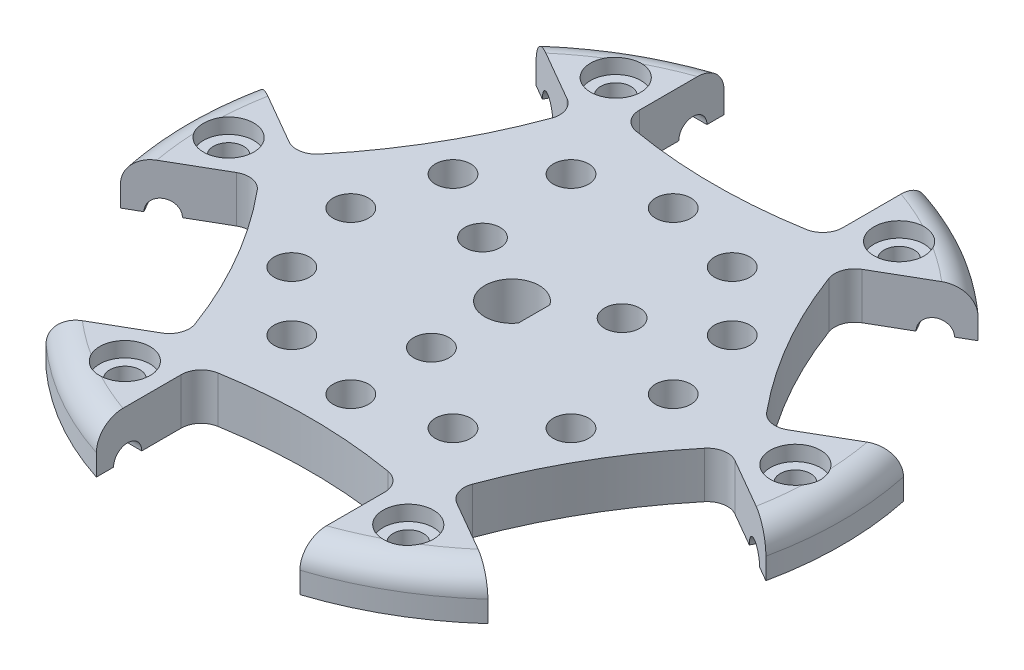
from build123d import *

# Parameters (mm, degrees)
CORTE_EXTRUS_O2_DEPTH = 10
ESBO_O5_W             = 25.2
ESBO_O5_H             = 1.4
ESBO_O10_W            = 25.2
ESBO_O10_H            = 1.4
ESBO_O12_R            = 1.75
ESBO_O12_R_2          = 1.3
CORTE_EXTRUS_O4_DEPTH = 46.434293366
ESBO_O13_R            = 2.05
ESBO_O13_R_2          = 2.04
CORTE_EXTRUS_O5_DEPTH = 1.5
CORTE_EXTRUS_O6_DEPTH = 46.434293366
ESBO_O15_R            = 1.5
CORTE_EXTRUS_O7_DEPTH = 46.434293366
ESBO_O16_R            = 2.5
CORTE_EXTRUS_O8_DEPTH = 1.5
CORTE_EXTRUS_O9_DEPTH = 46.434293366


with BuildPart() as part:
    # Esboço1 → Revolução3 (revolve)
    with BuildSketch(Plane.XY, mode=Mode.PRIVATE) as revolu_o3_sk:
        with BuildLine():
            Line((-32.75, 2.1), (-32.75, 0))
            Line((-32.75, 0), (0, 0))
            Line((0, 0), (0, 4.6))
            Line((0, 4.6), (-6.07, 4.6))
            Line((-6.07, 4.6), (-30.25, 4.6))
            ThreePointArc((-30.25, 4.6), (-32.017766953, 3.867766953), (-32.75, 2.1))
        make_face()
    revolve(revolu_o3_sk.sketch.rotate(Axis((0, 0, 0), (0, 1, 0)), 270), axis=Axis((0, 0, 0), (0, 1, 0)))

    # Esboço3 → Corte-extrusão2 (cut)
    with BuildSketch(Plane.XZ):
        with BuildLine():
            Line((-10.1, 71.55), (10.1, 71.55))
            Line((10.1, 71.55), (10.1, 22.738373522))
            ThreePointArc((10.1, 22.738373522), (9.628888485, 21.448993826), (8.4375, 20.767055752))
            ThreePointArc((8.4375, 20.767055752), (0, 20.05), (-8.4375, 20.767055752))
            ThreePointArc((-8.4375, 20.767055752), (-9.628888485, 21.448993826), (-10.1, 22.738373522))
            Line((-10.1, 22.738373522), (-10.1, 71.55))
        make_face()
        with BuildLine():
            Line((10.1, -71.55), (-10.1, -71.55))
            Line((-10.1, -71.55), (-10.1, -22.738373522))
            ThreePointArc((-10.1, -22.738373522), (-9.628888485, -21.448993826), (-8.4375, -20.767055752))
            ThreePointArc((-8.4375, -20.767055752), (0, -20.05), (8.4375, -20.767055752))
            ThreePointArc((8.4375, -20.767055752), (9.628888485, -21.448993826), (10.1, -22.738373522))
            Line((10.1, -22.738373522), (10.1, -71.55))
        make_face()
        with BuildLine():
            Line((56.914117641, 44.521856578), (67.014117641, 27.028143422))
            Line((67.014117641, 27.028143422), (24.742009111, 2.622330183))
            ThreePointArc((24.742009111, 2.622330183), (23.389817782, 2.385634875), (22.203547843, 3.076438532))
            ThreePointArc((22.203547843, 3.076438532), (17.363809346, 10.025), (13.766047843, 17.69061722))
            ThreePointArc((13.766047843, 17.69061722), (13.760929296, 19.063358951), (14.642009111, 20.116043339))
            Line((14.642009111, 20.116043339), (56.914117641, 44.521856578))
        make_face()
        with BuildLine():
            Line((-56.914117641, -44.521856578), (-67.014117641, -27.028143422))
            Line((-67.014117641, -27.028143422), (-24.742009111, -2.622330183))
            ThreePointArc((-24.742009111, -2.622330183), (-23.389817782, -2.385634875), (-22.203547843, -3.076438532))
            ThreePointArc((-22.203547843, -3.076438532), (-17.363809346, -10.025), (-13.766047843, -17.69061722))
            ThreePointArc((-13.766047843, -17.69061722), (-13.760929296, -19.063358951), (-14.642009111, -20.116043339))
            Line((-14.642009111, -20.116043339), (-56.914117641, -44.521856578))
        make_face()
        with BuildLine():
            Line((-67.014117641, 27.028143422), (-56.914117641, 44.521856578))
            Line((-56.914117641, 44.521856578), (-14.642009111, 20.116043339))
            ThreePointArc((-14.642009111, 20.116043339), (-13.760929296, 19.063358951), (-13.766047843, 17.69061722))
            ThreePointArc((-13.766047843, 17.69061722), (-17.363809346, 10.025), (-22.203547843, 3.076438532))
            ThreePointArc((-22.203547843, 3.076438532), (-23.389817782, 2.385634875), (-24.742009111, 2.622330183))
            Line((-24.742009111, 2.622330183), (-67.014117641, 27.028143422))
        make_face()
        with BuildLine():
            Line((67.014117641, -27.028143422), (56.914117641, -44.521856578))
            Line((56.914117641, -44.521856578), (14.642009111, -20.116043339))
            ThreePointArc((14.642009111, -20.116043339), (13.760929296, -19.063358951), (13.766047843, -17.69061722))
            ThreePointArc((13.766047843, -17.69061722), (17.363809346, -10.025), (22.203547843, -3.076438532))
            ThreePointArc((22.203547843, -3.076438532), (23.389817782, -2.385634875), (24.742009111, -2.622330183))
            Line((24.742009111, -2.622330183), (67.014117641, -27.028143422))
        make_face()
    extrude(amount=-CORTE_EXTRUS_O2_DEPTH, mode=Mode.SUBTRACT)

    # Esboço5 → Corte-Revolução3 (revolve, cut)
    with BuildSketch(Plane.XZ):
        with Locations((0, 27.35)):
            Rectangle(ESBO_O5_W, ESBO_O5_H)
    revolve(axis=Axis((-12.6, 0, 28.05), (1, 0, 0)), mode=Mode.SUBTRACT)

    # Esboço6 → Corte-Revolução4 (revolve, cut)
    with BuildSketch(Plane.XZ):
        Polygon((-29.379577011, 2.413079912), (-16.779577011, 24.236920088), (-17.992012576, 24.936920088), (-30.592012576, 3.113079912), align=None)
    revolve(axis=Axis((-30.592012576, 0, 3.113079912), (0.49999999999999983, 0, 0.8660254037844388)), mode=Mode.SUBTRACT)

    # Esboço7 → Corte-Revolução5 (revolve, cut)
    with BuildSketch(Plane.XZ):
        Polygon((-16.779577011, -24.236920088), (-29.379577011, -2.413079912), (-30.592012576, -3.113079912), (-17.992012576, -24.936920088), align=None)
    revolve(axis=Axis((-17.992012576, 0, -24.936920088), (-0.4999999999999998, 0, 0.8660254037844388)), mode=Mode.SUBTRACT)

    # Esboço8 → Corte-Revolução6 (revolve, cut)
    with BuildSketch(Plane.XZ):
        Polygon((16.779577011, 24.236920088), (29.379577011, 2.413079912), (30.592012576, 3.113079912), (17.992012576, 24.936920088), align=None)
    revolve(axis=Axis((17.992012576, 0, 24.936920088), (0.5000000000000001, 0, -0.8660254037844386)), mode=Mode.SUBTRACT)

    # Esboço10 → Corte-Revolução7 (revolve, cut)
    with BuildSketch(Plane.XZ):
        with Locations((0, -27.35)):
            Rectangle(ESBO_O10_W, ESBO_O10_H)
    revolve(axis=Axis((12.6, 0, -28.05), (-1, 0, 0)), mode=Mode.SUBTRACT)

    # Esboço11 → Corte-Revolução8 (revolve, cut)
    with BuildSketch(Plane.XZ):
        Polygon((29.379577011, -2.413079912), (16.779577011, -24.236920088), (17.992012576, -24.936920088), (30.592012576, -3.113079912), align=None)
    revolve(axis=Axis((30.592012576, 0, -3.113079912), (-0.49999999999999994, 0, -0.8660254037844387)), mode=Mode.SUBTRACT)

    # Esboço12 → Corte-extrusão4 (cut, through all)
    with BuildSketch(Plane.XZ):
        with Locations(Location((0, 16, 0), (0, 0, 270))):
            Circle(ESBO_O12_R)
        with Locations(Location((-8, 13.856406461, 0), (0, 0, 270))):
            Circle(ESBO_O12_R)
        with Locations(Location((-13.856406461, 8, 0), (0, 0, 270))):
            Circle(ESBO_O12_R)
        with Locations(Location((-16, 0, 0), (0, 0, 270))):
            Circle(ESBO_O12_R)
        with Locations(Location((-13.856406461, -8, 0), (0, 0, 270))):
            Circle(ESBO_O12_R)
        with Locations(Location((-8, -13.856406461, 0), (0, 0, 270))):
            Circle(ESBO_O12_R)
        with Locations(Location((0, -16, 0), (0, 0, 270))):
            Circle(ESBO_O12_R)
        with Locations(Location((8, -13.856406461, 0), (0, 0, 270))):
            Circle(ESBO_O12_R)
        with Locations(Location((13.856406461, -8, 0), (0, 0, 270))):
            Circle(ESBO_O12_R)
        with Locations(Location((16, 0, 0), (0, 0, 270))):
            Circle(ESBO_O12_R)
        with Locations(Location((13.856406461, 8, 0), (0, 0, 270))):
            Circle(ESBO_O12_R)
        with Locations(Location((8, 13.856406461, 0), (0, 0, 270))):
            Circle(ESBO_O12_R)
        with Locations(Location((28.129577011, 0, 0), (0, 0, 270))):
            Circle(ESBO_O12_R_2)
        with Locations(Location((14.064788505, 24.360928289, 0), (0, 0, 270))):
            Circle(ESBO_O12_R_2)
        with Locations(Location((-14.064788505, 24.360928289, 0), (0, 0, 270))):
            Circle(ESBO_O12_R_2)
        with Locations(Location((-28.129577011, 0, 0), (0, 0, 270))):
            Circle(ESBO_O12_R_2)
        with Locations(Location((14.064788505, -24.360928289, 0), (0, 0, 270))):
            Circle(ESBO_O12_R_2)
        with Locations(Location((-14.064788505, -24.360928289, 0), (0, 0, 270))):
            Circle(ESBO_O12_R_2)
        with Locations(Location((0, 8, 0), (0, 0, 270))):
            Circle(ESBO_O12_R)
        with Locations(Location((-6.92820323, -4, 0), (0, 0, 270))):
            Circle(ESBO_O12_R)
        with Locations(Location((6.92820323, -4, 0), (0, 0, 270))):
            Circle(ESBO_O12_R)
    extrude(amount=-CORTE_EXTRUS_O4_DEPTH, mode=Mode.SUBTRACT)

    # Esboço13 → Corte-extrusão5 (cut)
    with BuildSketch(Plane(origin=(0, 4.6, 0), x_dir=(1, 0, 0), z_dir=(0, 1, 0))):
        with Locations(Location((-14.064788505, 24.360928289, 0), (0, 0, 270))):
            Circle(ESBO_O13_R)
        with Locations(Location((-28.129577011, 0, 0), (0, 0, 270))):
            Circle(ESBO_O13_R)
        with Locations(Location((-14.064788505, -24.360928289, 0), (0, 0, 270))):
            Circle(ESBO_O13_R)
        with Locations(Location((14.064788505, -24.360928289, 0), (0, 0, 270))):
            Circle(ESBO_O13_R)
        with Locations(Location((28.129577011, 0, 0), (0, 0, 270))):
            Circle(ESBO_O13_R_2)
        with Locations(Location((14.064788505, 24.360928289, 0), (0, 0, 270))):
            Circle(ESBO_O13_R_2)
    extrude(amount=-CORTE_EXTRUS_O5_DEPTH, mode=Mode.SUBTRACT)

    # Esboço14 → Corte-extrusão6 (cut, through all)
    with BuildSketch(Plane.XZ):
        with BuildLine():
            Line((2.1, 1.532970972), (2.1, -1.532970972))
            ThreePointArc((2.1, -1.532970972), (-2.6, 0), (2.1, 1.532970972))
        make_face()
    extrude(amount=-CORTE_EXTRUS_O6_DEPTH, mode=Mode.SUBTRACT)

    # Esboço15 → Corte-extrusão7 (cut, through all)
    with BuildSketch(Plane(origin=(0, 4.6, 0), x_dir=(1, 0, 0), z_dir=(0, 1, 0))):
        with Locations(Location((-14.064788505, 24.360928289, 0), (0, 0, 270))):
            Circle(ESBO_O15_R)
        with Locations(Location((14.064788505, 24.360928289, 0), (0, 0, 270))):
            Circle(ESBO_O15_R)
        with Locations(Location((-14.064788505, -24.360928289, 0), (0, 0, 270))):
            Circle(ESBO_O15_R)
        with Locations(Location((14.064788505, -24.360928289, 0), (0, 0, 270))):
            Circle(ESBO_O15_R)
        with Locations(Location((-28.129577011, 0, 0), (0, 0, 270))):
            Circle(ESBO_O15_R)
        with Locations(Location((28.129577011, 0, 0), (0, 0, 270))):
            Circle(ESBO_O15_R)
    extrude(amount=-CORTE_EXTRUS_O7_DEPTH, mode=Mode.SUBTRACT)

    # Esboço16 → Corte-extrusão8 (cut)
    with BuildSketch(Plane(origin=(0, 4.6, 0), x_dir=(1, 0, 0), z_dir=(0, 1, 0))):
        with Locations(Location((-14.064788505, 24.360928289, 0), (0, 0, 270))):
            Circle(ESBO_O16_R)
        with Locations(Location((14.064788505, 24.360928289, 0), (0, 0, 270))):
            Circle(ESBO_O16_R)
        with Locations(Location((-14.064788505, -24.360928289, 0), (0, 0, 270))):
            Circle(ESBO_O16_R)
        with Locations(Location((14.064788505, -24.360928289, 0), (0, 0, 270))):
            Circle(ESBO_O16_R)
        with Locations(Location((28.129577011, 0, 0), (0, 0, 270))):
            Circle(ESBO_O16_R)
        with Locations(Location((-28.129577011, 0, 0), (0, 0, 270))):
            Circle(ESBO_O16_R)
    extrude(amount=-CORTE_EXTRUS_O8_DEPTH, mode=Mode.SUBTRACT)

    # Esboço18 → Corte-extrusão9 (cut, through all)
    with BuildSketch(Plane(origin=(0, 4.6, 0), x_dir=(1, 0, 0), z_dir=(0, 1, 0))):
        with BuildLine():
            Line((2.2, -1.565247584), (2.2, 1.565247584))
            ThreePointArc((2.2, 1.565247584), (-2.7, 0), (2.2, -1.565247584))
        make_face()
    extrude(amount=-CORTE_EXTRUS_O9_DEPTH, mode=Mode.SUBTRACT)


solid = part.part
